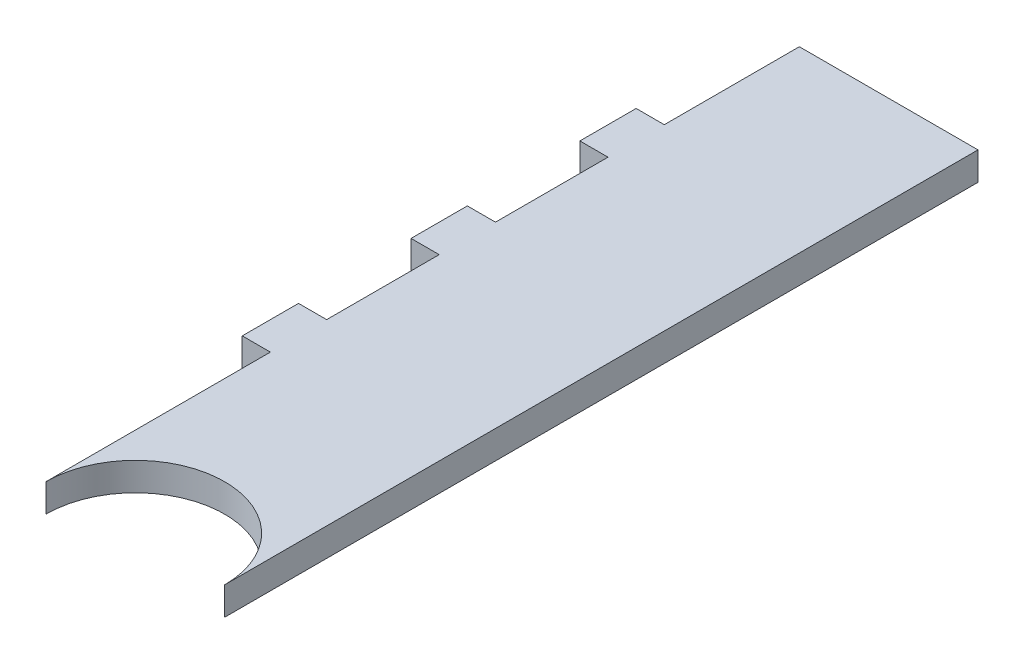
from build123d import *

# Parameters (mm, degrees)
BOSS_EXTRUDE1_DEPTH = 5


with BuildPart() as part:
    # Sketch9 → Boss-Extrude1 (new body)
    with BuildSketch(Plane(origin=(0, 0, 0), x_dir=(1, 0, 0), z_dir=(0, 1, 0))):
        with BuildLine():
            Line((-15.875, 109.875), (-15.875, 133.875))
            Line((-15.875, 133.875), (15.875, 133.875))
            Line((15.875, 133.875), (15.875, 0))
            ThreePointArc((15.875, 0), (0, 15.875), (-15.875, 0))
            Line((-15.875, 0), (-15.875, 39.875))
            Line((-15.875, 39.875), (-20.875, 39.875))
            Line((-20.875, 39.875), (-20.875, 49.875))
            Line((-20.875, 49.875), (-15.875, 49.875))
            Line((-15.875, 49.875), (-15.875, 69.875))
            Line((-15.875, 69.875), (-20.875, 69.875))
            Line((-20.875, 69.875), (-20.875, 79.875))
            Line((-20.875, 79.875), (-15.875, 79.875))
            Line((-15.875, 79.875), (-15.875, 99.875))
            Line((-15.875, 99.875), (-20.875, 99.875))
            Line((-20.875, 99.875), (-20.875, 109.875))
            Line((-20.875, 109.875), (-15.875, 109.875))
        make_face()
    extrude(amount=BOSS_EXTRUDE1_DEPTH)


solid = part.part
